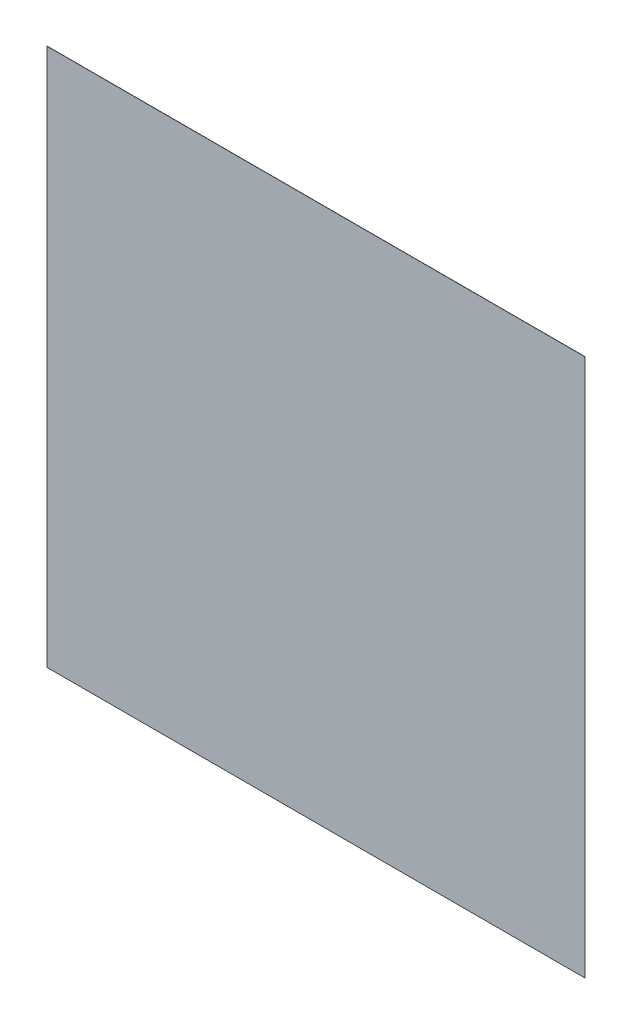
from build123d import *

# Parameters (mm, degrees)
SKETCH1_W           = 300
SKETCH1_H           = 300
BOSS_EXTRUDE1_DEPTH = 0.1


with BuildPart() as part:
    # Sketch1 → Boss-Extrude1 (new body)
    with BuildSketch(Plane.XY):
        Rectangle(SKETCH1_W, SKETCH1_H)
    extrude(amount=BOSS_EXTRUDE1_DEPTH)


solid = part.part
